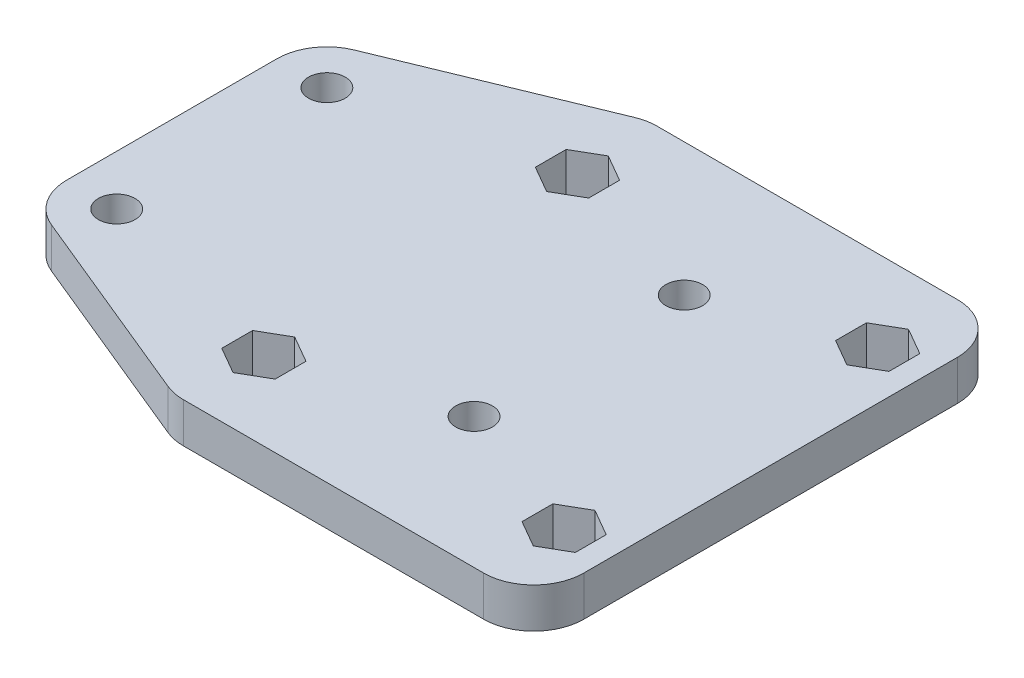
from build123d import *

# Parameters (mm, degrees)
SKETCH1_R               = 7.5
SKETCH1_R_2             = 2.75
SKETCH1_R_3             = 2.5
BOSS_EXTRUDE1_DEPTH     = 6
CUT_EXTRUDE1_DEPTH      = 70.758959998
CUT_EXTRUDE1_DEPTH_BACK = 70.758959998


with BuildPart() as part:
    # Sketch1 → Boss-Extrude1 (new body)
    # profile 1 of 7: a face of its own
    with BuildSketch(Plane(origin=(0, 0, 0), x_dir=(1, 0, 0), z_dir=(0, 1, 0))):
        with Locations((-52.25, 15.75)):
            Circle(SKETCH1_R)
        with Locations(Location((-52.25, 15.75, 0), (0, 0, 270))):
            Circle(SKETCH1_R_2, mode=Mode.SUBTRACT)
    # profile 2 of 7: a face of its own
    with BuildSketch(Plane(origin=(0, 0, 0), x_dir=(1, 0, 0), z_dir=(0, 1, 0))):
        with BuildLine():
            ThreePointArc((-44.75, 15.75), (-52.25, 8.25), (-59.75, 15.75))
            Line((-59.75, 15.75), (-59.75, -15.75))
            ThreePointArc((-59.75, -15.75), (-52.25, -8.25), (-44.75, -15.75))
            ThreePointArc((-44.75, -15.75), (-48.076702535, -21.981660154), (-55.105623539, -22.685085739))
            Line((-55.105623539, -22.685085739), (-25.355623539, -34.935085739))
            ThreePointArc((-25.355623539, -34.935085739), (-26.673297465, -21.768339846), (-15, -28))
            ThreePointArc((-15, -28), (-17.196699141, -33.303300859), (-22.5, -35.5))
            Line((-22.5, -35.5), (22.5, -35.5))
            ThreePointArc((22.5, -35.5), (17.196699141, -22.696699141), (30, -28))
            Line((30, -28), (30, 28))
            ThreePointArc((30, 28), (17.196699141, 22.696699141), (22.5, 35.5))
            Line((22.5, 35.5), (-22.5, 35.5))
            ThreePointArc((-22.5, 35.5), (-17.196699141, 33.303300859), (-15, 28))
            ThreePointArc((-15, 28), (-26.673297465, 21.768339846), (-25.355623539, 34.935085739))
            Line((-25.355623539, 34.935085739), (-55.105623539, 22.685085739))
            ThreePointArc((-55.105623539, 22.685085739), (-48.076702535, 21.981660154), (-44.75, 15.75))
        make_face()
        with Locations(Location((1.450255215, -15.893794378, 0), (0, 0, 270))):
            Circle(SKETCH1_R_2, mode=Mode.SUBTRACT)
        with Locations(Location((1.450255215, 15.606205622, 0), (0, 0, 270))):
            Circle(SKETCH1_R_2, mode=Mode.SUBTRACT)
    # profile 3 of 7: a face of its own
    with BuildSketch(Plane(origin=(0, 0, 0), x_dir=(1, 0, 0), z_dir=(0, 1, 0))):
        with Locations((-52.25, -15.75)):
            Circle(SKETCH1_R)
        with Locations(Location((-52.25, -15.75, 0), (0, 0, 270))):
            Circle(SKETCH1_R_2, mode=Mode.SUBTRACT)
    # profile 4 of 7: a face of its own
    with BuildSketch(Plane(origin=(0, 0, 0), x_dir=(1, 0, 0), z_dir=(0, 1, 0))):
        with Locations((-22.5, -28)):
            Circle(SKETCH1_R)
        with Locations(Location((-22.299744785, -23.643794378, 0), (0, 0, 270))):
            Circle(SKETCH1_R_3, mode=Mode.SUBTRACT)
    # profile 5 of 7: a face of its own
    with BuildSketch(Plane(origin=(0, 0, 0), x_dir=(1, 0, 0), z_dir=(0, 1, 0))):
        with Locations((22.5, -28)):
            Circle(SKETCH1_R)
        with Locations(Location((22.700255215, -23.643794378, 0), (0, 0, 270))):
            Circle(SKETCH1_R_3, mode=Mode.SUBTRACT)
    # profile 6 of 7: a face of its own
    with BuildSketch(Plane(origin=(0, 0, 0), x_dir=(1, 0, 0), z_dir=(0, 1, 0))):
        with Locations((22.5, 28)):
            Circle(SKETCH1_R)
        with Locations(Location((22.700255215, 23.356205622, 0), (0, 0, 270))):
            Circle(SKETCH1_R_3, mode=Mode.SUBTRACT)
    # profile 7 of 7: a face of its own
    with BuildSketch(Plane(origin=(0, 0, 0), x_dir=(1, 0, 0), z_dir=(0, 1, 0))):
        with Locations((-22.5, 28)):
            Circle(SKETCH1_R)
        with Locations(Location((-22.299744785, 23.356205622, 0), (0, 0, 270))):
            Circle(SKETCH1_R_3, mode=Mode.SUBTRACT)
    extrude(amount=BOSS_EXTRUDE1_DEPTH)

    # Sketch2 → Cut-Extrude1 (cut, two sides: drawn at the far end of the back side and taken through both)
    with BuildSketch(Plane(origin=(0, 6, 0), x_dir=(1, 0, 0), z_dir=(0, 1, 0)).offset(-CUT_EXTRUDE1_DEPTH_BACK)):
        Polygon((-22.299744785, 18.737403469), (-18.299744785, 21.046804546), (-18.299744785, 25.665606699), (-22.299744785, 27.975007776), (-26.299744785, 25.665606699), (-26.299744785, 21.046804546), align=None)
        Polygon((-22.299744785, -19.024992224), (-26.299744785, -21.334393301), (-26.299744785, -25.953195454), (-22.299744785, -28.262596531), (-18.299744785, -25.953195454), (-18.299744785, -21.334393301), align=None)
        Polygon((18.700255215, -25.953195454), (22.700255215, -28.262596531), (26.700255215, -25.953195454), (26.700255215, -21.334393301), (22.700255215, -19.024992224), (18.700255215, -21.334393301), align=None)
        Polygon((22.700255215, 18.737403469), (26.700255215, 21.046804546), (26.700255215, 25.665606699), (22.700255215, 27.975007776), (18.700255215, 25.665606699), (18.700255215, 21.046804546), align=None)
    extrude(amount=CUT_EXTRUDE1_DEPTH + CUT_EXTRUDE1_DEPTH_BACK, mode=Mode.SUBTRACT)


solid = part.part
